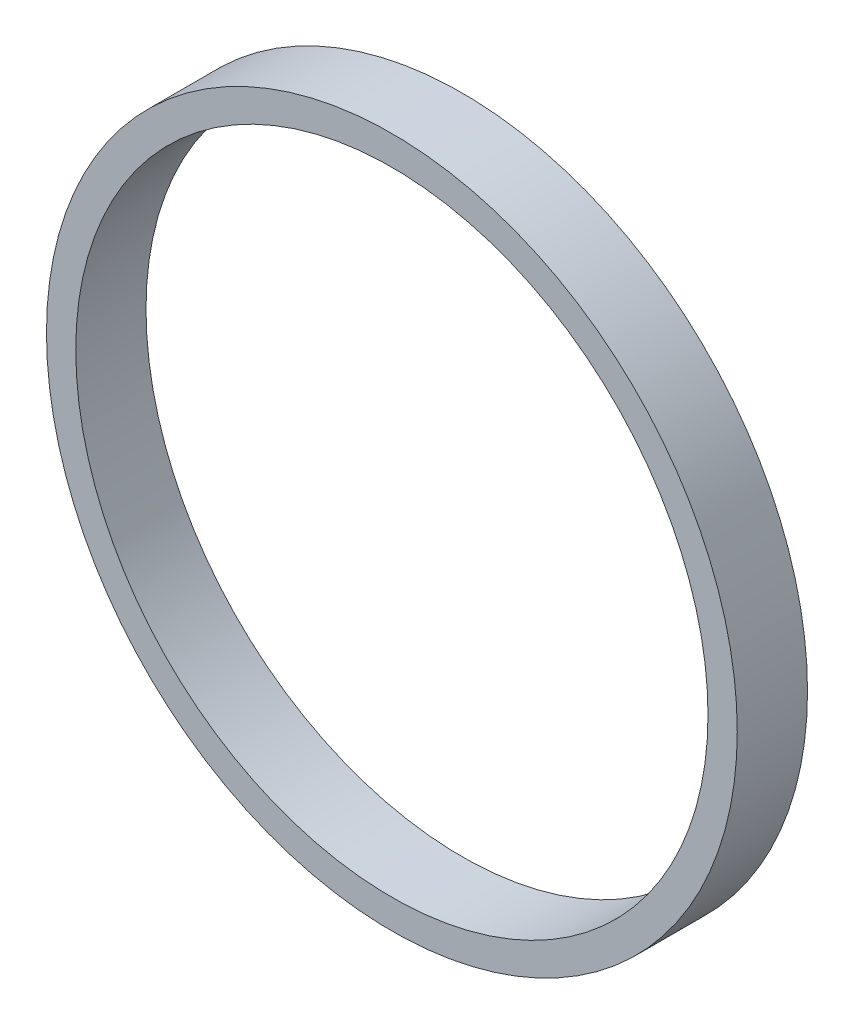
from build123d import *

# Parameters (mm, degrees)
SKETCH1_R           = 59
SKETCH1_R_2         = 54
BOSS_EXTRUDE1_DEPTH = 12


with BuildPart() as part:
    # Sketch1 → Boss-Extrude1 (new body)
    with BuildSketch(Plane.XY):
        Circle(SKETCH1_R)
        Circle(SKETCH1_R_2, mode=Mode.SUBTRACT)
    extrude(amount=BOSS_EXTRUDE1_DEPTH)


solid = part.part
